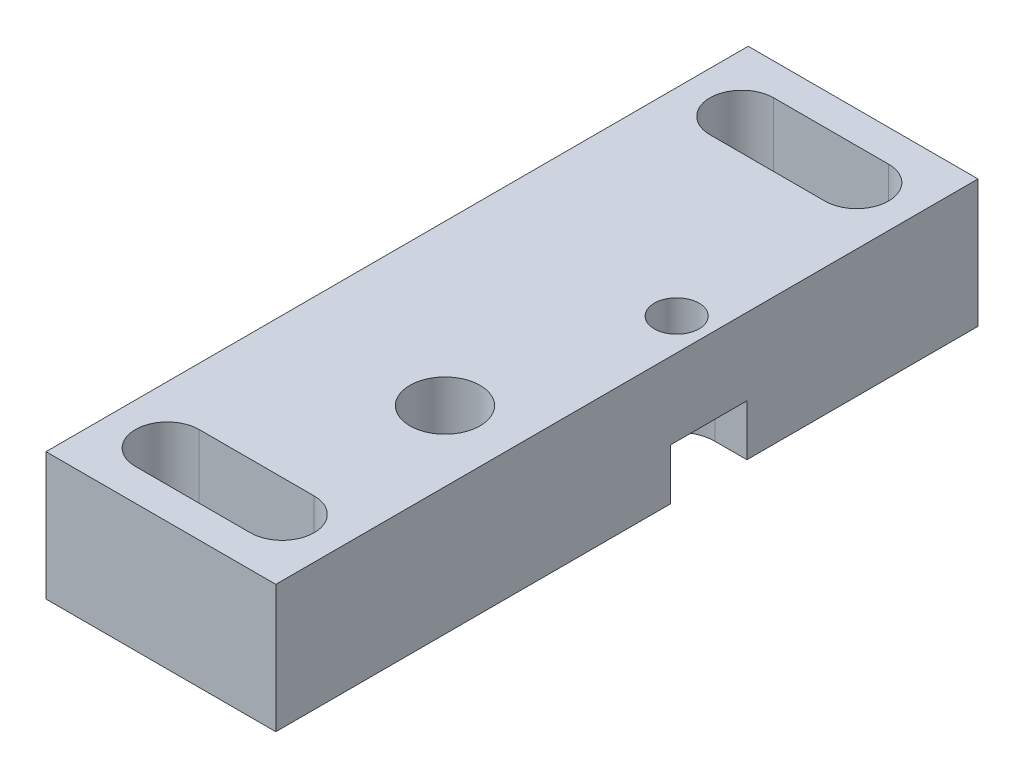
from build123d import *

# Parameters (mm, degrees)
SKETCH1_W           = 18
SKETCH1_H           = 55
BOSS_EXTRUDE1_DEPTH = 10
SKETCH2_R           = 2.75
SKETCH2_R_2         = 1.75
CUT_EXTRUDE1_DEPTH  = 31.61453903
SKETCH3_R           = 4.75
CUT_EXTRUDE2_DEPTH  = 5.5
CUT_EXTRUDE3_START  = -4
SKETCH4_R           = 1.75
CUT_EXTRUDE3_DEPTH  = 4
SKETCH5_R           = 2.5
CUT_EXTRUDE4_DEPTH  = 31.61453903


with BuildPart() as part:
    # Sketch1 → Boss-Extrude1 (new body)
    with BuildSketch(Plane(origin=(0, 0, 0), x_dir=(1, 0, 0), z_dir=(0, 1, 0))):
        Rectangle(SKETCH1_W, SKETCH1_H)
    extrude(amount=BOSS_EXTRUDE1_DEPTH)

    # Sketch2 → Cut-Extrude1 (cut, through all)
    with BuildSketch(Plane(origin=(0, 10, 0), x_dir=(1, 0, 0), z_dir=(0, 1, 0))):
        with Locations(Location((3.5, -8.75, 0), (0, 0, 270))):
            Circle(SKETCH2_R)
        with Locations(Location((6.5, 6.4, 0), (0, 0, 270))):
            Circle(SKETCH2_R_2)
    extrude(amount=-CUT_EXTRUDE1_DEPTH, mode=Mode.SUBTRACT)

    # Sketch3 → Cut-Extrude2 (cut)
    with BuildSketch(Plane.XZ):
        with Locations(Location((3.5, 8.75, 0), (0, 0, 270))):
            Circle(SKETCH3_R)
    extrude(amount=-CUT_EXTRUDE2_DEPTH, mode=Mode.SUBTRACT)

    # Sketch4 → Cut-Extrude3 (cut)
    # profile 1 of 3: a face of its own
    with BuildSketch(Plane.XZ.offset(CUT_EXTRUDE3_START)):
        with BuildLine():
            ThreePointArc((6.5, -3.4), (3.5, -6.4), (6.5, -9.4))
            ThreePointArc((6.5, -9.4), (7.918637165, -9.043382037), (9, -8.058312395))
            Line((9, -8.058312395), (9, -4.741687605))
            ThreePointArc((9, -4.741687605), (7.918637165, -3.756617963), (6.5, -3.4))
        make_face()
        with Locations(Location((6.5, -6.4, 0), (0, 0, 90))):
            Circle(SKETCH4_R, mode=Mode.SUBTRACT)
    # profile 2 of 3: a face of its own
    with BuildSketch(Plane.XZ.offset(CUT_EXTRUDE3_START)):
        with BuildLine():
            ThreePointArc((9, -8.058312395), (7.918637165, -9.043382037), (6.5, -9.4))
            Line((6.5, -9.4), (9, -9.4))
            Line((9, -9.4), (9, -8.058312395))
        make_face()
    # profile 3 of 3: a face of its own
    with BuildSketch(Plane.XZ.offset(CUT_EXTRUDE3_START)):
        with BuildLine():
            Line((9, -3.4), (6.5, -3.4))
            ThreePointArc((6.5, -3.4), (7.918637165, -3.756617963), (9, -4.741687605))
            Line((9, -4.741687605), (9, -3.4))
        make_face()
    extrude(amount=CUT_EXTRUDE3_DEPTH, mode=Mode.SUBTRACT)

    # Sketch5 → Cut-Extrude4 (cut, through all)
    with BuildSketch(Plane(origin=(0, 0, 0), x_dir=(1, 0, 0), z_dir=(0, 1, 0))):
        with Locations((-4.5, 22.5)):
            Circle(SKETCH5_R)
        with BuildLine():
            Line((4.5, 25), (-4.5, 25))
            ThreePointArc((-4.5, 25), (-2.732233047, 24.267766953), (-2, 22.5))
            ThreePointArc((-2, 22.5), (-2.732233047, 20.732233047), (-4.5, 20))
            Line((-4.5, 20), (4.5, 20))
            ThreePointArc((4.5, 20), (2, 22.5), (4.5, 25))
        make_face()
        with Locations((4.5, 22.5)):
            Circle(SKETCH5_R)
        with Locations((-4.5, -22.5)):
            Circle(SKETCH5_R)
        with BuildLine():
            ThreePointArc((4.5, -25), (2, -22.5), (4.5, -20))
            Line((4.5, -20), (-4.5, -20))
            ThreePointArc((-4.5, -20), (-2.732233047, -20.732233047), (-2, -22.5))
            ThreePointArc((-2, -22.5), (-2.732233047, -24.267766953), (-4.5, -25))
            Line((-4.5, -25), (4.5, -25))
        make_face()
        with Locations((4.5, -22.5)):
            Circle(SKETCH5_R)
    extrude(amount=CUT_EXTRUDE4_DEPTH, mode=Mode.SUBTRACT)


solid = part.part
